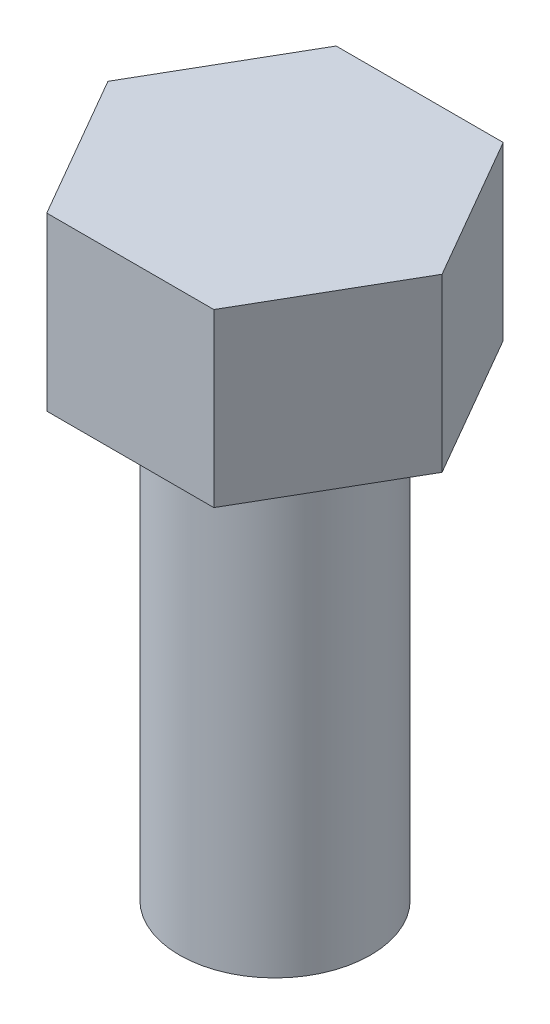
from build123d import *

# Parameters (mm, degrees)
BOSS_EXTRUDE1_DEPTH     = 4.8
SKETCH3_R               = 2.675
BOSS_EXTRUDE2_DEPTH     = 28.7
FILLET1_R               = 0.25
CUT_EXTRUDE1_DEPTH      = 30.358769452
CUT_EXTRUDE1_DEPTH_BACK = 30.358769452
SKETCH4_W               = 15.294544115
SKETCH4_H               = 19.173595159


with BuildPart() as part:
    # Sketch2 → Boss-Extrude1 (new body)
    with BuildSketch(Plane(origin=(0, 0, 0), x_dir=(1, 0, 0), z_dir=(0, 1, 0))):
        Polygon((-2.3375, 4.048668763), (-4.675, 0), (-2.3375, -4.048668763), (2.3375, -4.048668763), (4.675, 0), (2.3375, 4.048668763), align=None)
    extrude(amount=BOSS_EXTRUDE1_DEPTH)

    # Sketch3 → Boss-Extrude2 (add)
    with BuildSketch(Plane.XZ):
        with Locations(Location((0, 0, 0), (0, 0, 270))):
            Circle(SKETCH3_R)
    extrude(amount=BOSS_EXTRUDE2_DEPTH)

    # Fillet1
    fillet1_edges = [part.edges().sort_by_distance(p)[0] for p in [
        (0, 0, 2.675),
    ]]
    fillet(fillet1_edges, radius=FILLET1_R)

    # Sketch4 → Cut-Extrude1 (cut, two sides: drawn at the far end of the back side and taken through both)
    with BuildSketch(Plane.XY.offset(-CUT_EXTRUDE1_DEPTH_BACK)):
        with Locations((0.498735134, -22.286797579)):
            Rectangle(SKETCH4_W, SKETCH4_H)
    extrude(amount=CUT_EXTRUDE1_DEPTH + CUT_EXTRUDE1_DEPTH_BACK, mode=Mode.SUBTRACT)


solid = part.part
